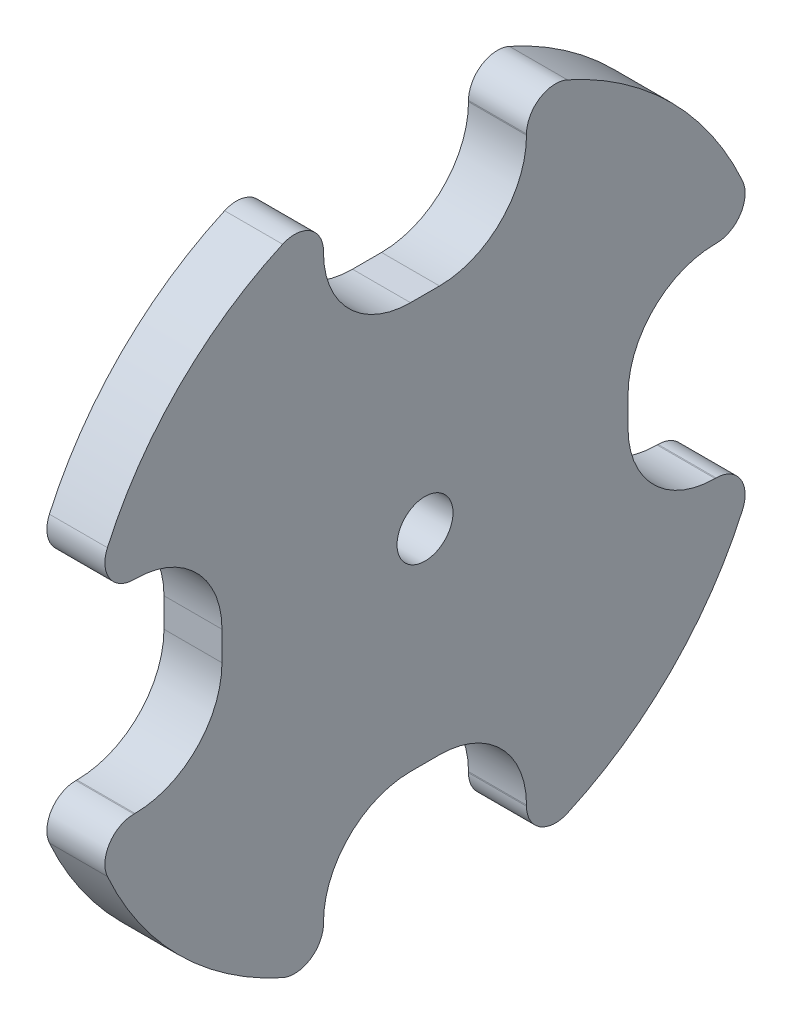
from build123d import *

# Parameters (mm, degrees)
SKETCH1_R           = 12
SKETCH1_R_2         = 0.965
BOSS_EXTRUDE1_DEPTH = 2
CUT_EXTRUDE1_DEPTH  = 18.088007491
CIRPATTERN3_COUNT   = 4
FILLET5_R           = 1


with BuildPart() as part:
    # Sketch1 → Boss-Extrude1 (new body)
    with BuildSketch(Plane(origin=(0, 0, 0), x_dir=(0, 0, -1), z_dir=(1, 0, 0))):
        Circle(SKETCH1_R)
        Circle(SKETCH1_R_2, mode=Mode.SUBTRACT)
    extrude(amount=BOSS_EXTRUDE1_DEPTH)

    # Sketch1<3> → Cut-Extrude1 (cut, through all)
    with BuildSketch(Plane(origin=(0, 0, 0), x_dir=(0, 0, -1), z_dir=(1, 0, 0))):
        with BuildLine():
            Line((-3.5, 11.478240283), (-3.5, 10))
            ThreePointArc((-3.5, 10), (-2.621320344, 7.878679656), (-0.5, 7))
            Line((-0.5, 7), (0.5, 7))
            ThreePointArc((0.5, 7), (2.621320344, 7.878679656), (3.5, 10))
            Line((3.5, 10), (3.5, 11.478240283))
            ThreePointArc((3.5, 11.478240283), (0, 12), (-3.5, 11.478240283))
        make_face()
    cut_extrude1 = extrude(amount=CUT_EXTRUDE1_DEPTH, mode=Mode.SUBTRACT)

    # CirPattern3: Cut-Extrude1 ×4 about axis
    cirpattern3_axis = Axis((2, 0, 0), (-1, 0, 0))
    for i in range(1, CIRPATTERN3_COUNT):
        add(cut_extrude1.rotate(cirpattern3_axis, i * 360 / CIRPATTERN3_COUNT), mode=Mode.SUBTRACT)

    # Fillet5
    fillet5_edges = [part.edges().sort_by_distance(p)[0] for p in [
        (1, -11.478240283, -3.5),
        (1, -11.478240283, 3.5),
        (1, -3.5, 11.478240283),
        (1, 3.5, 11.478240283),
        (1, -3.5, -11.478240283),
        (1, 3.5, -11.478240283),
        (1, 11.478240283, -3.5),
        (1, 11.478240283, 3.5),
    ]]
    fillet(fillet5_edges, radius=FILLET5_R)


solid = part.part
